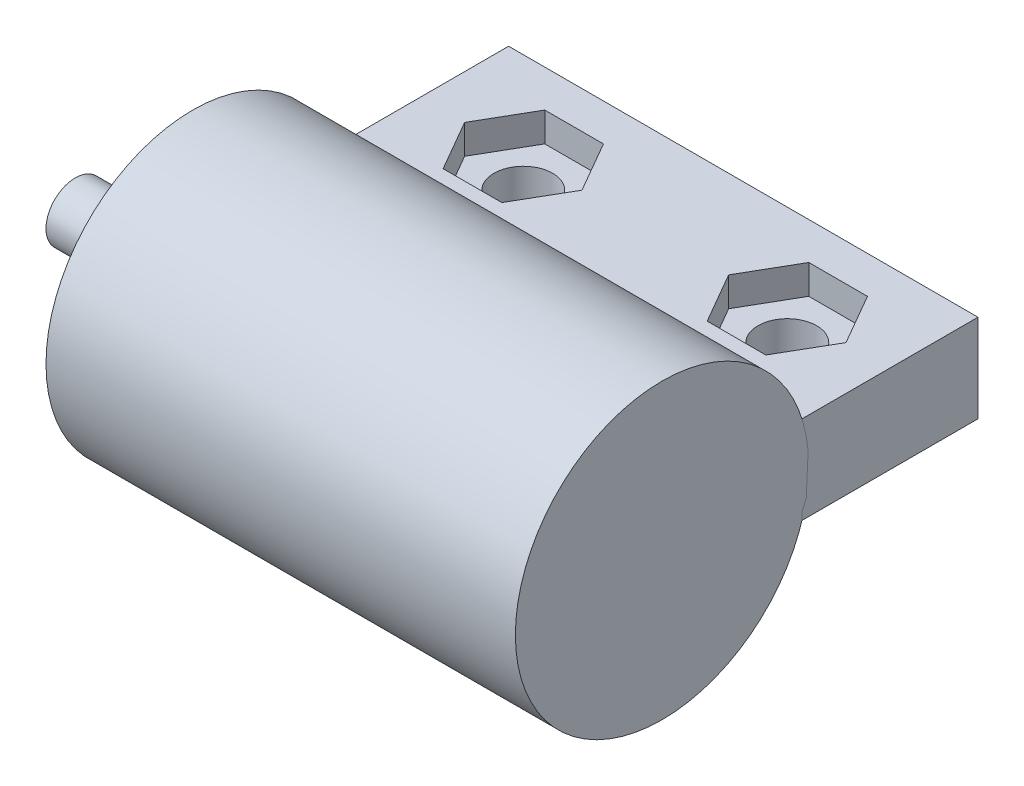
from build123d import *

# Parameters (mm, degrees)
SKETCH_1_W      = 8
SKETCH_1_H      = 3
SKETCH_1_R      = 0.5
EXTRUDE_1_DEPTH = 1
SKETCH_2_W      = 8
SKETCH_2_H      = 3
EXTRUDE_2_DEPTH = 0.5
SKETCH_3_R      = 2.5
EXTRUDE_3_DEPTH = 8
SKETCH_5_R      = 0.5
EXTRUDE_4_DEPTH = 2


with BuildPart() as part:
    # 草图1 → 凸台-拉伸1 (new body)
    with BuildSketch(Plane(origin=(0, 0, 0), x_dir=(1, 0, 0), z_dir=(0, 1, 0))):
        with Locations((4, 1.5)):
            Rectangle(SKETCH_1_W, SKETCH_1_H)
        with Locations(Location((1.75, 1.5, 0), (0, 0, 270))):
            Circle(SKETCH_1_R, mode=Mode.SUBTRACT)
        with Locations(Location((6.25, 1.5, 0), (0, 0, 270))):
            Circle(SKETCH_1_R, mode=Mode.SUBTRACT)
    extrude(amount=EXTRUDE_1_DEPTH)

    # 草图2 → 凸台-拉伸2 (add)
    with BuildSketch(Plane(origin=(0, 1, 0), x_dir=(1, 0, 0), z_dir=(0, 1, 0))):
        with Locations((4, 1.5)):
            Rectangle(SKETCH_2_W, SKETCH_2_H)
        Polygon((2.25, 0.633974596), (1.25, 0.633974596), (0.75, 1.5), (1.25, 2.366025404), (2.25, 2.366025404), (2.75, 1.5), align=None, mode=Mode.SUBTRACT)
        Polygon((5.75, 2.366025404), (5.25, 1.5), (5.75, 0.633974596), (6.75, 0.633974596), (7.25, 1.5), (6.75, 2.366025404), align=None, mode=Mode.SUBTRACT)
    extrude(amount=EXTRUDE_2_DEPTH)


with BuildPart() as body_2:
    # 草图3 → 凸台-拉伸3 (new body)
    with BuildSketch(Plane(origin=(8, 0, 0), x_dir=(0, 0, -1), z_dir=(1, 0, 0))):
        with Locations((-2.384848004, 0.75)):
            Circle(SKETCH_3_R)
    extrude(amount=-EXTRUDE_3_DEPTH)

    # 草图5 → 凸台-拉伸4 (add)
    with BuildSketch(Plane.ZY):
        with Locations((2.384848004, 0.75)):
            Circle(SKETCH_5_R)
    extrude(amount=EXTRUDE_4_DEPTH)


solid = Compound([part.part, body_2.part])
